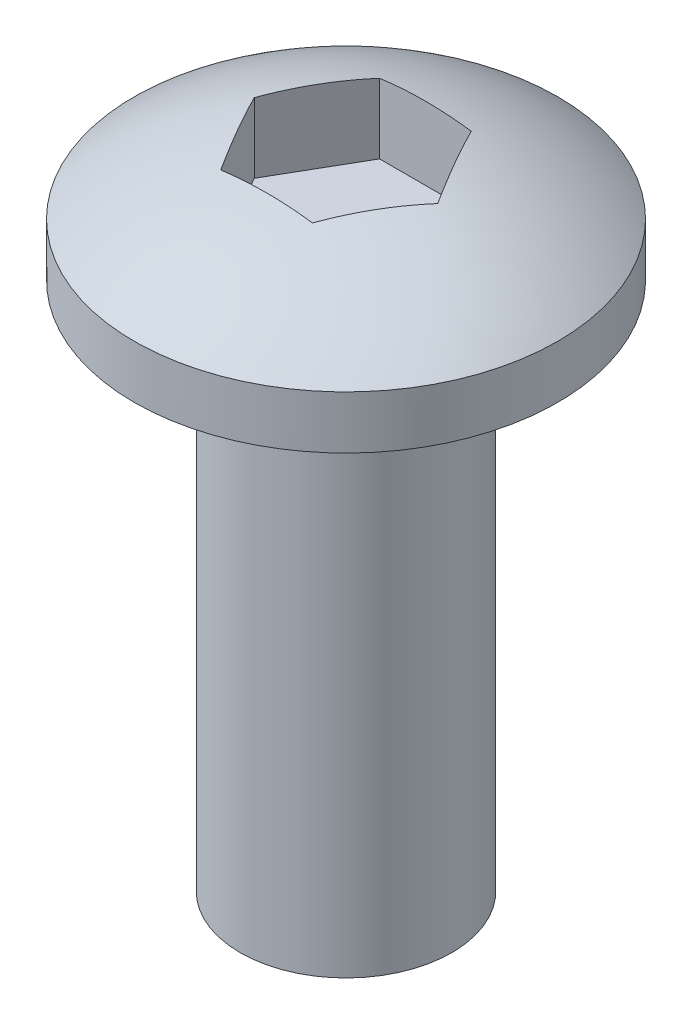
from build123d import *

# Parameters (mm, degrees)
SKETCH1_R           = 1
BOSS_EXTRUDE1_DEPTH = 5
CUT_EXTRUDE1_START  = 6.5
CUT_EXTRUDE1_DEPTH  = 1.1


with BuildPart() as part:
    # Sketch1 → Boss-Extrude1 (new body)
    with BuildSketch(Plane(origin=(0, 0, 0), x_dir=(1, 0, 0), z_dir=(0, 1, 0))):
        with Locations(Location((0, 0, 0), (0, 0, 270))):
            Circle(SKETCH1_R)
    extrude(amount=BOSS_EXTRUDE1_DEPTH)

    # Sketch2 → Revolve2 (revolve)
    with BuildSketch(Plane.XY, mode=Mode.PRIVATE) as revolve2_sk:
        with BuildLine():
            Line((0, 5), (-2, 5))
            Line((-2, 5), (-2, 5.5))
            ThreePointArc((-2, 5.5), (-1.055436608, 6.001787176), (0, 6.17511905))
            Line((0, 6.17511905), (0, 5))
        make_face()
    revolve(revolve2_sk.sketch.rotate(Axis((0, 5, 0), (0, 1, 0)), 180), axis=Axis((0, 5, 0), (0, 1, 0)))

    # Sketch3 → Cut-Extrude1 (cut)
    with BuildSketch(Plane(origin=(0, 0, 0), x_dir=(1, 0, 0), z_dir=(0, 1, 0)).offset(CUT_EXTRUDE1_START)):
        Polygon((0.433012702, -0.75), (0.866025404, 0), (0.433012702, 0.75), (-0.433012702, 0.75), (-0.866025404, 0), (-0.433012702, -0.75), align=None)
    extrude(amount=-CUT_EXTRUDE1_DEPTH, mode=Mode.SUBTRACT)


solid = part.part
